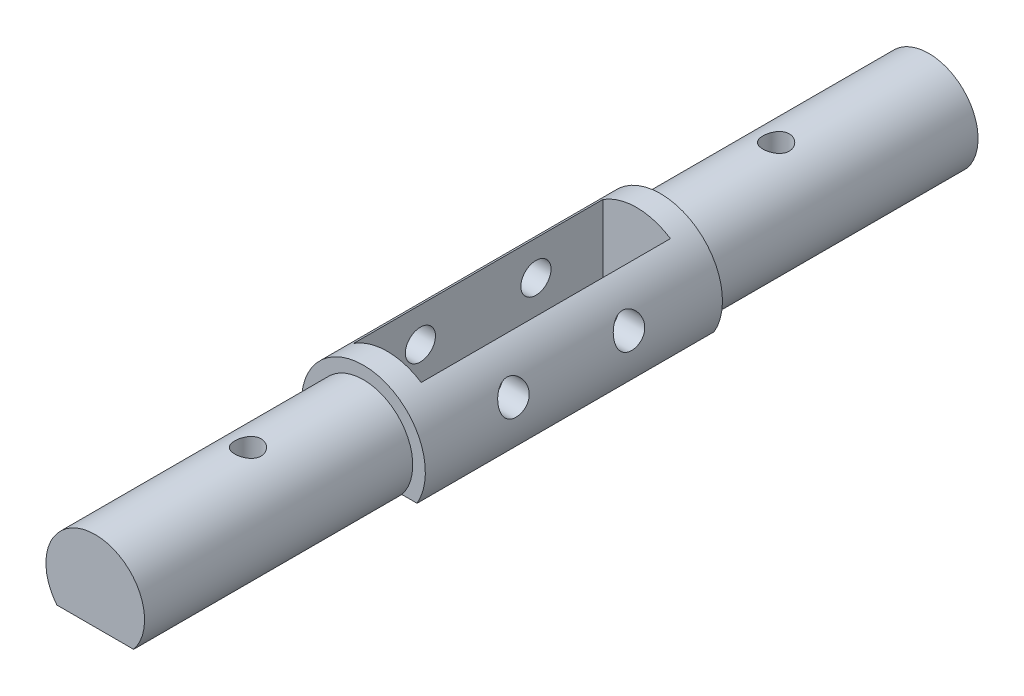
from build123d import *

# Parameters (mm, degrees)
BOSS_EXTRUDE1_DEPTH     = 101
CUT_EXTRUDE1_START      = -32.5
SKETCH3_R               = 7.5
SKETCH3_R_2             = 5.975
CUT_EXTRUDE1_DEPTH      = 32.5
SKETCH4_R               = 7.5
SKETCH4_R_2             = 5.975
CUT_EXTRUDE2_DEPTH      = 32.5
CUT_EXTRUDE3_DEPTH      = 102.900993616
CUT_EXTRUDE3_DEPTH_BACK = 102.900993616
SKETCH5_W               = 8.2
SKETCH5_H               = 30.2
CUT_EXTRUDE4_DEPTH      = 103.382859894
CUT_EXTRUDE4_DEPTH_BACK = 103.382859894
HOLE1_D                 = 3.2
HOLE1_CSINK_D           = 6.3
HOLE1_CSINK_ANGLE       = 90


with BuildPart() as part:
    # Sketch1 → Boss-Extrude1 (new body)
    with BuildSketch(Plane.XY):
        with BuildLine():
            ThreePointArc((7.5, 0), (-1.941142838, 7.244443697), (-6.495190528, -3.75))
            Line((-6.495190528, -3.75), (6.495190528, -3.75))
            ThreePointArc((6.495190528, -3.75), (7.244443697, -1.941142838), (7.5, 0))
        make_face()
    extrude(amount=BOSS_EXTRUDE1_DEPTH)

    # Sketch3 → Cut-Extrude1 (cut)
    with BuildSketch(Plane.XY.offset(101).offset(CUT_EXTRUDE1_START)):
        Circle(SKETCH3_R)
        Circle(SKETCH3_R_2, mode=Mode.SUBTRACT)
    extrude(amount=CUT_EXTRUDE1_DEPTH, mode=Mode.SUBTRACT)

    # Sketch4 → Cut-Extrude2 (cut)
    with BuildSketch(Plane(origin=(0, 0, 0), x_dir=(-1, 0, 0), z_dir=(0, 0, -1))):
        Circle(SKETCH4_R)
        Circle(SKETCH4_R_2, mode=Mode.SUBTRACT)
    extrude(amount=-CUT_EXTRUDE2_DEPTH, mode=Mode.SUBTRACT)

    # Sketch5 → Cut-Extrude3 (cut, two sides: drawn at the far end of the back side and taken through both)
    with BuildSketch(Plane.XZ.offset(3.75).offset(-CUT_EXTRUDE3_DEPTH_BACK)):
        with Locations((0, 50.5)):
            Rectangle(SKETCH5_W, SKETCH5_H)
    extrude(amount=CUT_EXTRUDE3_DEPTH + CUT_EXTRUDE3_DEPTH_BACK, mode=Mode.SUBTRACT)

    # Sketch10 → Cut-Extrude4 (cut, two sides: drawn at the far end of the back side and taken through both)
    with BuildSketch(Plane.ZY.offset(7.5).offset(-CUT_EXTRUDE4_DEPTH_BACK)):
        with BuildLine():
            ThreePointArc((45.325, 2.112742786), (43.5, 3.937742786), (41.675, 2.112742786))
            Line((41.675, 2.112742786), (45.325, 2.112742786))
        make_face()
        with BuildLine():
            Line((45.325, 2.112742786), (41.675, 2.112742786))
            ThreePointArc((41.675, 2.112742786), (43.5, 0.287742786), (45.325, 2.112742786))
        make_face()
        with BuildLine():
            ThreePointArc((59.325, 2.112742786), (57.5, 3.937742786), (55.675, 2.112742786))
            Line((55.675, 2.112742786), (59.325, 2.112742786))
        make_face()
        with BuildLine():
            Line((59.325, 2.112742786), (55.675, 2.112742786))
            ThreePointArc((55.675, 2.112742786), (57.5, 0.287742786), (59.325, 2.112742786))
        make_face()
    extrude(amount=CUT_EXTRUDE4_DEPTH + CUT_EXTRUDE4_DEPTH_BACK, mode=Mode.SUBTRACT)

    # Hole1 (through all)
    with Locations(Plane(origin=(0, -3.75, 82.5), x_dir=(0, 0, -1), z_dir=(0, -1, 0))):
        with Locations((0, 0), (64, 0)):
            CounterSinkHole(HOLE1_D / 2, HOLE1_CSINK_D / 2, counter_sink_angle=HOLE1_CSINK_ANGLE)


solid = part.part
